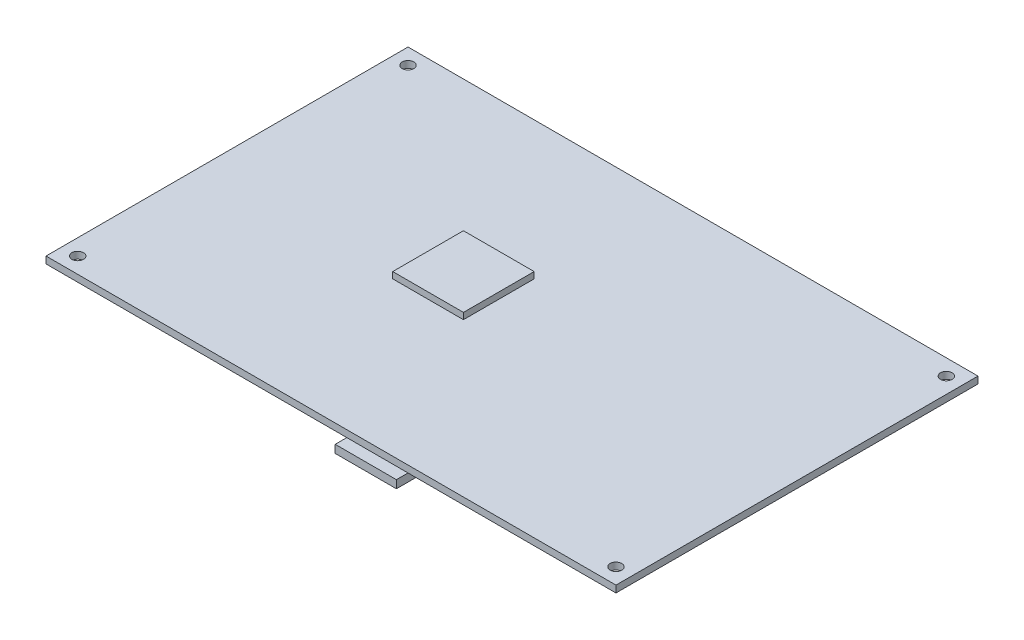
from build123d import *

# Parameters (mm, degrees)
SKETCH1_W           = 137.16
SKETCH1_H           = 87.122
SKETCH1_R           = 1.397
BOSS_EXTRUDE1_DEPTH = 1.651
SKETCH2_W           = 14.732
SKETCH2_H           = 14.5288
BOSS_EXTRUDE2_DEPTH = 1.905
SKETCH3_W           = 17.018
SKETCH3_H           = 17.018
BOSS_EXTRUDE3_DEPTH = 1.524


with BuildPart() as part:
    # Sketch1 → Boss-Extrude1 (new body)
    with BuildSketch(Plane(origin=(0, 0, 0), x_dir=(1, 0, 0), z_dir=(0, 1, 0))):
        with Locations((-68.58, 43.561)):
            Rectangle(SKETCH1_W, SKETCH1_H)
        with Locations(Location((-133.35, 83.312, 0), (0, 0, 90))):
            Circle(SKETCH1_R, mode=Mode.SUBTRACT)
        with Locations(Location((-3.81, 3.81, 0), (0, 0, 90))):
            Circle(SKETCH1_R, mode=Mode.SUBTRACT)
        with Locations(Location((-3.81, 83.312, 0), (0, 0, 90))):
            Circle(SKETCH1_R, mode=Mode.SUBTRACT)
        with Locations(Location((-133.35, 3.81, 0), (0, 0, 90))):
            Circle(SKETCH1_R, mode=Mode.SUBTRACT)
    extrude(amount=BOSS_EXTRUDE1_DEPTH)

    # Sketch2 → Boss-Extrude2 (add)
    with BuildSketch(Plane.XZ):
        with Locations((-57.404, -4.4704)):
            Rectangle(SKETCH2_W, SKETCH2_H)
    extrude(amount=BOSS_EXTRUDE2_DEPTH)

    # Sketch3 → Boss-Extrude3 (add)
    with BuildSketch(Plane(origin=(0, 1.651, 0), x_dir=(1, 0, 0), z_dir=(0, 1, 0))):
        with Locations((-82.169, 45.466)):
            Rectangle(SKETCH3_W, SKETCH3_H)
    extrude(amount=BOSS_EXTRUDE3_DEPTH)


solid = part.part
